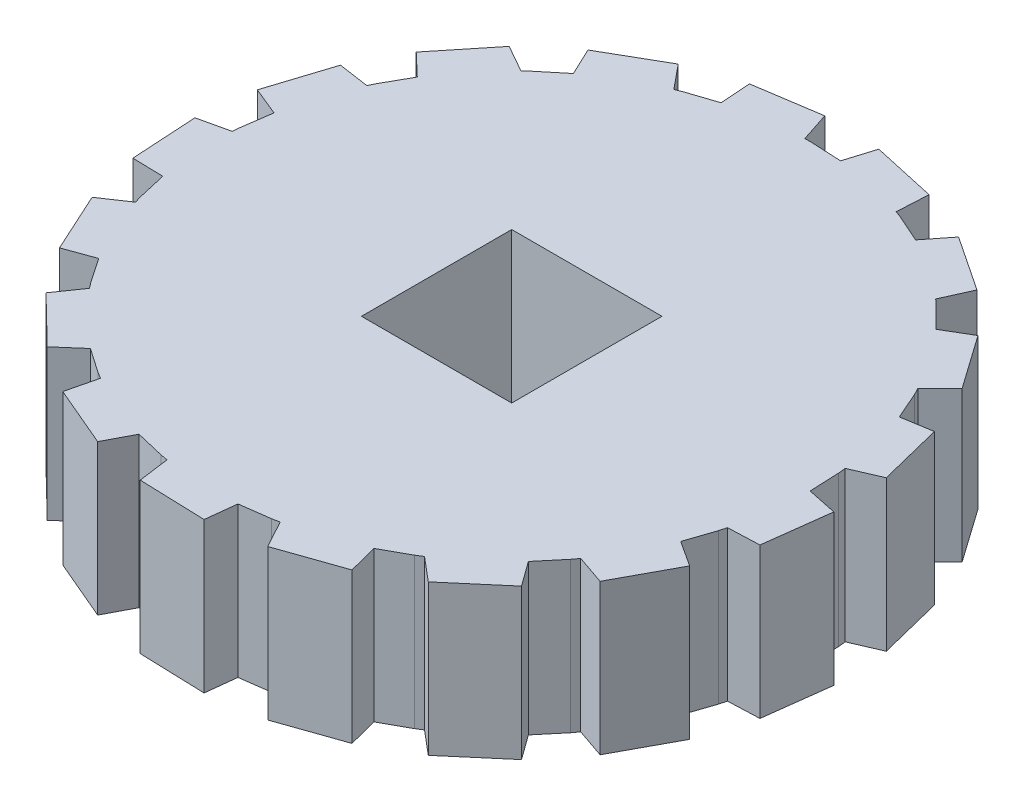
from build123d import *

# Parameters (mm, degrees)
BELT_PULLEY_W       = 6.35
BELT_PULLEY_H       = 6.35
BOSS_EXTRUDE1_DEPTH = 6.35


with BuildPart() as part:
    # Belt Pulley → Boss-Extrude1 (new body)
    with BuildSketch(Plane(origin=(0, 0, 0), x_dir=(1, 0, 0), z_dir=(0, 1, 0))):
        with BuildLine():
            Line((1.26, 12.637341493), (0, 12.7))
            ThreePointArc((0, 12.7), (-0.15491433, 12.699055144), (-0.30980561, 12.696220717))
            Line((-0.30980561, 12.696220717), (-0.720511879, 13.951407192))
            Line((-0.720511879, 13.951407192), (-3.482396619, 13.528998994))
            Line((-3.482396619, 13.528998994), (-3.390219288, 12.239134495))
            Line((-3.390219288, 12.239134495), (-4.587769161, 11.842397313))
            ThreePointArc((-4.587769161, 11.842397313), (-4.73188115, 11.785554751), (-4.875289053, 11.726958542))
            Line((-4.875289053, 11.726958542), (-5.711686898, 12.749020856))
            Line((-5.711686898, 12.749020856), (-8.134476277, 11.357429097))
            Line((-8.134476277, 11.357429097), (-7.582570675, 10.187964564))
            Line((-7.582570675, 10.187964564), (-8.555934674, 9.385413249))
            ThreePointArc((-8.555934674, 9.385413249), (-8.6697812, 9.280349882), (-8.782337696, 9.173905635))
            Line((-8.782337696, 9.173905635), (-9.931466951, 9.824808608))
            Line((-9.931466951, 9.824808608), (-11.68794984, 7.651975467))
            Line((-11.68794984, 7.651975467), (-10.750853876, 6.760853565))
            Line((-10.750853876, 6.760853565), (-11.3685738, 5.660877118))
            ThreePointArc((-11.3685738, 5.660877118), (-11.436779259, 5.521782338), (-11.503282968, 5.381865938))
            Line((-11.503282968, 5.381865938), (-12.809947361, 5.573701517))
            Line((-12.809947361, 5.573701517), (-13.662901012, 2.913080148))
            Line((-13.662901012, 2.913080148), (-12.467174689, 2.42065183))
            Line((-12.467174689, 2.42065183), (-12.645824039, 1.171808165))
            ThreePointArc((-12.645824039, 1.171808165), (-12.659176905, 1.017467492), (-12.670646133, 0.862975423))
            Line((-12.670646133, 0.862975423), (-13.958373397, 0.569835151))
            Line((-13.958373397, 0.569835151), (-13.792601693, -2.219242786))
            Line((-13.792601693, -2.219242786), (-12.499734477, -2.246472349))
            Line((-12.499734477, -2.246472349), (-12.215185668, -3.475519974))
            ThreePointArc((-12.215185668, -3.475519974), (-12.171882563, -3.624261977), (-12.126768327, -3.772464704))
            Line((-12.126768327, -3.772464704), (-13.22164376, -4.510990609))
            Line((-13.22164376, -4.510990609), (-12.059535088, -7.051844685))
            Line((-12.059535088, -7.051844685), (-10.84413586, -6.610197989))
            Line((-10.84413586, -6.610197989), (-10.134818786, -7.653459882))
            ThreePointArc((-10.134818786, -7.653459882), (-10.040708034, -7.776514783), (-9.945103262, -7.898412569))
            Line((-9.945103262, -7.898412569), (-10.69925787, -8.982582092))
            Line((-10.69925787, -8.982582092), (-8.697761445, -10.932055883))
            Line((-8.697761445, -10.932055883), (-7.723976606, -10.081179762))
            Line((-7.723976606, -10.081179762), (-6.685688469, -10.797757624))
            ThreePointArc((-6.685688469, -10.797757624), (-6.553480248, -10.878506177), (-6.420296894, -10.957636049))
            Line((-6.420296894, -10.957636049), (-6.731877917, -12.241026089))
            Line((-6.731877917, -12.241026089), (-4.161306924, -13.335832358))
            Line((-4.161306924, -13.335832358), (-3.560651511, -12.190642346))
            Line((-3.560651511, -12.190642346), (-2.333618876, -12.483758366))
            ThreePointArc((-2.333618876, -12.483758366), (-2.18116864, -12.511295031), (-2.028393854, -12.536970063))
            Line((-2.028393854, -12.536970063), (-1.855320549, -13.846251683))
            Line((-1.855320549, -13.846251683), (0.937155157, -13.938530777))
            Line((0.937155157, -13.938530777), (1.0835593, -12.653691131))
            Line((1.0835593, -12.653691131), (2.333618876, -12.483758366))
            ThreePointArc((2.333618876, -12.483758366), (2.485721879, -12.454364164), (2.637455015, -12.423116801))
            Line((2.637455015, -12.423116801), (3.271808139, -13.581464262))
            Line((3.271808139, -13.581464262), (5.90904924, -12.658753378))
            Line((5.90904924, -12.658753378), (5.581429424, -11.407788812))
            Line((5.581429424, -11.407788812), (6.685688469, -10.797757624))
            ThreePointArc((6.685688469, -10.797757624), (6.816901884, -10.715402405), (6.94710097, -10.631452775))
            Line((6.94710097, -10.631452775), (7.957061009, -11.482424835))
            Line((7.957061009, -11.482424835), (10.082893481, -9.66934119))
            Line((10.082893481, -9.66934119), (9.325496576, -8.621201402))
            Line((9.325496576, -8.621201402), (10.134818786, -7.653459882))
            ThreePointArc((10.134818786, -7.653459882), (10.227421516, -7.529266175), (10.318502444, -7.403952141))
            Line((10.318502444, -7.403952141), (11.567668698, -7.832620308))
            Line((11.567668698, -7.832620308), (12.894987085, -5.374030896))
            Line((12.894987085, -5.374030896), (11.810103742, -4.67027297))
            Line((11.810103742, -4.67027297), (12.215185668, -3.475519974))
            ThreePointArc((12.215185668, -3.475519974), (12.2566712, -3.326260827), (12.296332986, -3.176506744))
            Line((12.296332986, -3.176506744), (13.615998631, -3.124977006))
            Line((13.615998631, -3.124977006), (13.965541231, -0.35292795))
            Line((13.965541231, -0.35292795), (12.699690955, -0.088598295))
            Line((12.699690955, -0.088598295), (12.645824039, 1.171808165))
            ThreePointArc((12.645824039, 1.171808165), (12.630589522, 1.325974478), (12.613475622, 1.47994349))
            Line((12.613475622, 1.47994349), (13.825412499, 2.004711756))
            Line((13.825412499, 2.004711756), (13.149971647, 4.715839871))
            Line((13.149971647, 4.715839871), (11.874114533, 4.505042071))
            Line((11.874114533, 4.505042071), (11.3685738, 5.660877118))
            ThreePointArc((11.3685738, 5.660877118), (11.298676741, 5.799129581), (11.227098481, 5.936519156))
            Line((11.227098481, 5.936519156), (12.167627801, 6.863653088))
            Line((12.167627801, 6.863653088), (10.558425526, 9.147707386))
            Line((10.558425526, 9.147707386), (9.444873147, 8.490251542))
            Line((9.444873147, 8.490251542), (8.555934674, 9.385413249))
            ThreePointArc((8.555934674, 9.385413249), (8.440815058, 9.489080101), (8.324439479, 9.591335014))
            Line((8.324439479, 9.591335014), (8.866537544, 10.795620037))
            Line((8.866537544, 10.795620037), (6.540905531, 12.344126329))
            Line((6.540905531, 12.344126329), (5.740049306, 11.328805496))
            Line((5.740049306, 11.328805496), (4.587769161, 11.842397313))
            ThreePointArc((4.587769161, 11.842397313), (4.442974528, 11.897477772), (4.297518798, 11.950787931))
            Line((4.297518798, 11.950787931), (4.367972262, 13.269578679))
            Line((4.367972262, 13.269578679), (1.64, 13.873402611))
            Line((1.64, 13.873402611), (1.26, 12.637341493))
        make_face()
        Rectangle(BELT_PULLEY_W, BELT_PULLEY_H, mode=Mode.SUBTRACT)
    extrude(amount=BOSS_EXTRUDE1_DEPTH)


solid = part.part
